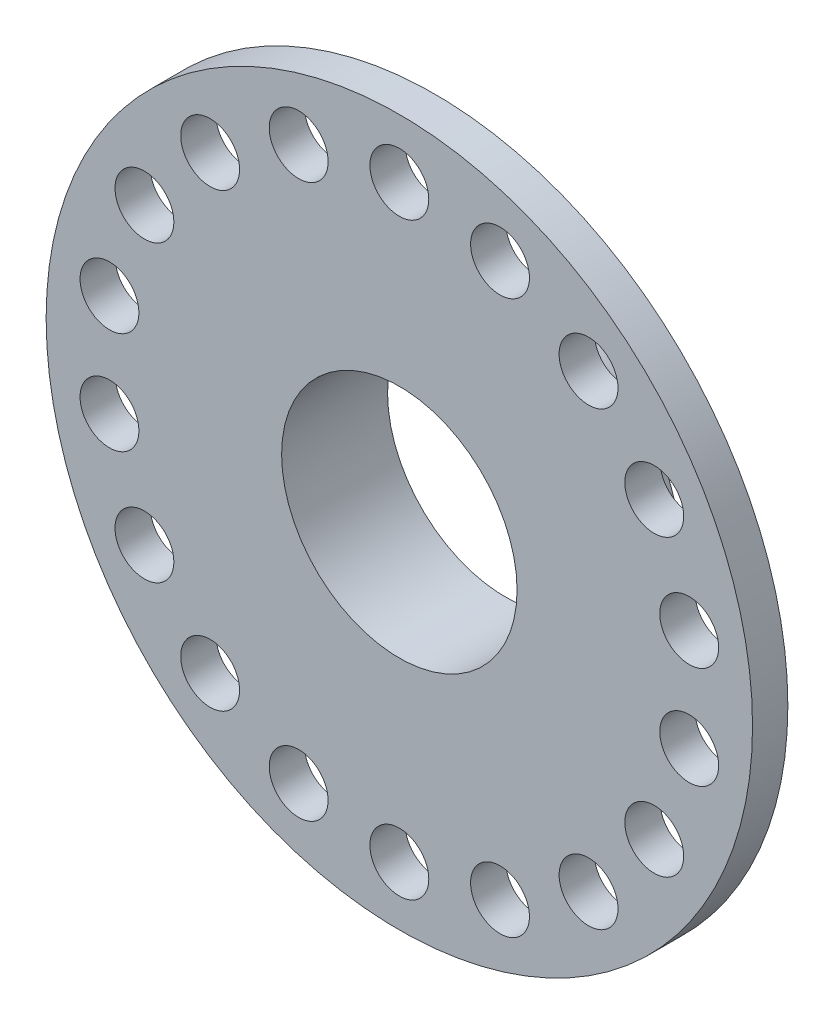
from build123d import *

# Parameters (mm, degrees)
SKETCH1_R           = 15
BOSS_EXTRUDE1_DEPTH = 6
SKETCH2_R           = 30
BOSS_EXTRUDE2_DEPTH = 3
SKETCH5_R           = 10
CUT_EXTRUDE2_DEPTH  = 44.370496884
SKETCH8_R           = 2.5
CUT_EXTRUDE3_DEPTH  = 44.370496884


with BuildPart() as part:
    # Sketch1 → Boss-Extrude1 (new body)
    with BuildSketch(Plane.XY):
        Circle(SKETCH1_R)
    extrude(amount=BOSS_EXTRUDE1_DEPTH)

    # Sketch2 → Boss-Extrude2 (add)
    with BuildSketch(Plane.XY.offset(6)):
        Circle(SKETCH2_R)
    extrude(amount=BOSS_EXTRUDE2_DEPTH)

    # Sketch5 → Cut-Extrude2 (cut, through all)
    with BuildSketch(Plane(origin=(0, 0, 0), x_dir=(-1, 0, 0), z_dir=(0, 0, -1))):
        Circle(SKETCH5_R)
    extrude(amount=-CUT_EXTRUDE2_DEPTH, mode=Mode.SUBTRACT)

    # Sketch8 → Cut-Extrude3 (cut, through all)
    with BuildSketch(Plane.XY.offset(9)):
        with Locations((0, 25)):
            Circle(SKETCH8_R)
        with Locations((8.550503583, 23.49231552)):
            Circle(SKETCH8_R)
        with Locations((16.069690242, 19.151111078)):
            Circle(SKETCH8_R)
        with Locations((21.650635095, 12.5)):
            Circle(SKETCH8_R)
        with Locations((24.620193825, 4.341204442)):
            Circle(SKETCH8_R)
        with Locations((24.620193825, -4.341204442)):
            Circle(SKETCH8_R)
        with Locations((21.650635095, -12.5)):
            Circle(SKETCH8_R)
        with Locations((16.069690242, -19.151111078)):
            Circle(SKETCH8_R)
        with Locations((8.550503583, -23.49231552)):
            Circle(SKETCH8_R)
        with Locations((0, -25)):
            Circle(SKETCH8_R)
        with Locations((-8.550503583, -23.49231552)):
            Circle(SKETCH8_R)
        with Locations((-16.069690242, -19.151111078)):
            Circle(SKETCH8_R)
        with Locations((-21.650635095, -12.5)):
            Circle(SKETCH8_R)
        with Locations((-24.620193825, -4.341204442)):
            Circle(SKETCH8_R)
        with Locations((-24.620193825, 4.341204442)):
            Circle(SKETCH8_R)
        with Locations((-21.650635095, 12.5)):
            Circle(SKETCH8_R)
        with Locations((-16.069690242, 19.151111078)):
            Circle(SKETCH8_R)
        with Locations((-8.550503583, 23.49231552)):
            Circle(SKETCH8_R)
    extrude(amount=-CUT_EXTRUDE3_DEPTH, mode=Mode.SUBTRACT)


solid = part.part
